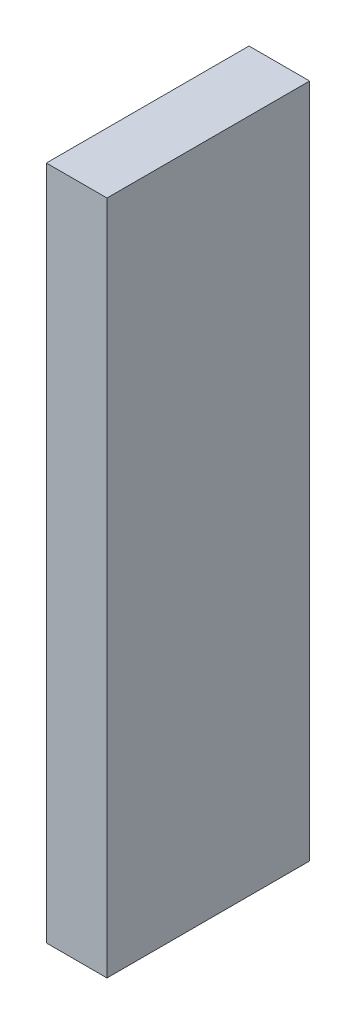
from build123d import *

# Parameters (mm, degrees)
ESQUISSE1_W        = 0.448717949
ESQUISSE1_H        = 5
BOSS_EXTRU_1_DEPTH = 1.5


with BuildPart() as part:
    # Esquisse1 → Boss.-Extru.1 (new body)
    with BuildSketch(Plane.XY):
        with Locations((-55.208106352, -20.370119076)):
            Rectangle(ESQUISSE1_W, ESQUISSE1_H)
    extrude(amount=BOSS_EXTRU_1_DEPTH)


solid = part.part
